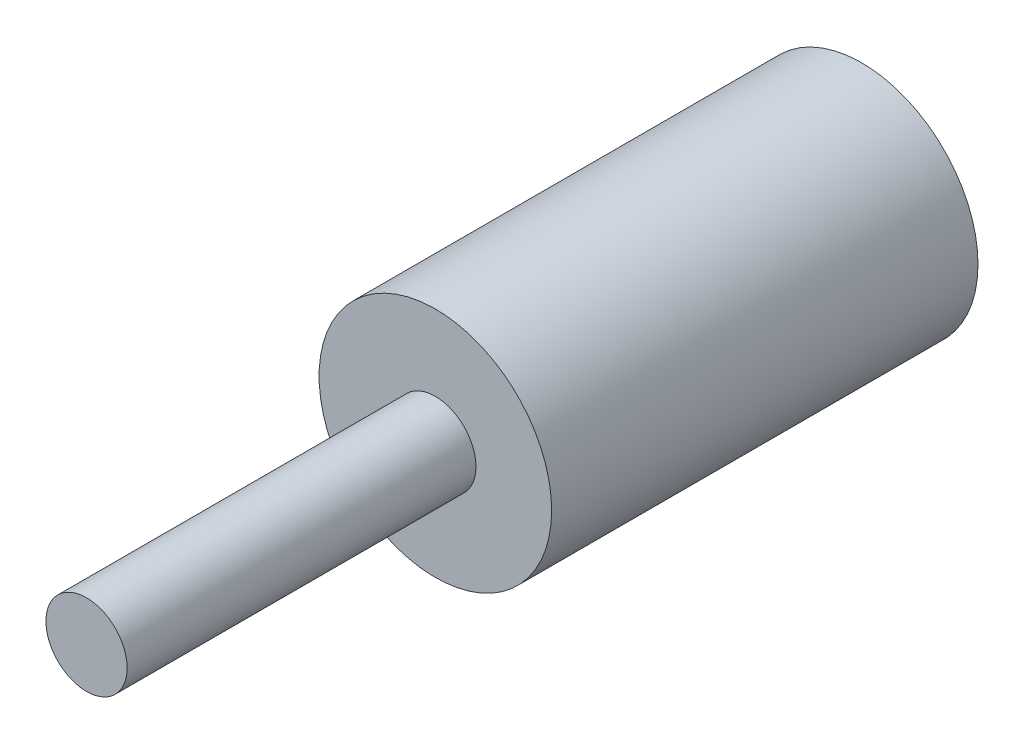
from build123d import *

# Parameters (mm, degrees)
SKETCH5_R           = 6
BOSS_EXTRUDE4_DEPTH = 40
SKETCH6_R           = 5
CUT_EXTRUDE1_DEPTH  = 20
CUT_EXTRUDE2_START  = -18
SKETCH7_R           = 6
CUT_EXTRUDE2_DEPTH  = 18
SKETCH8_R           = 2.095
BOSS_EXTRUDE5_DEPTH = 18


with BuildPart() as part:
    # Sketch5 → Boss-Extrude4 (new body)
    with BuildSketch(Plane.XY):
        Circle(SKETCH5_R)
    extrude(amount=BOSS_EXTRUDE4_DEPTH)

    # Sketch6 → Cut-Extrude1 (cut)
    with BuildSketch(Plane(origin=(0, 0, 0), x_dir=(-1, 0, 0), z_dir=(0, 0, -1))):
        Circle(SKETCH6_R)
    extrude(amount=-CUT_EXTRUDE1_DEPTH, mode=Mode.SUBTRACT)

    # Sketch7 → Cut-Extrude2 (cut)
    with BuildSketch(Plane.XY.offset(40).offset(CUT_EXTRUDE2_START)):
        Circle(SKETCH7_R)
    extrude(amount=CUT_EXTRUDE2_DEPTH, mode=Mode.SUBTRACT)

    # Sketch8 → Boss-Extrude5 (add)
    with BuildSketch(Plane.XY.offset(22)):
        Circle(SKETCH8_R)
    extrude(amount=BOSS_EXTRUDE5_DEPTH)


solid = part.part
